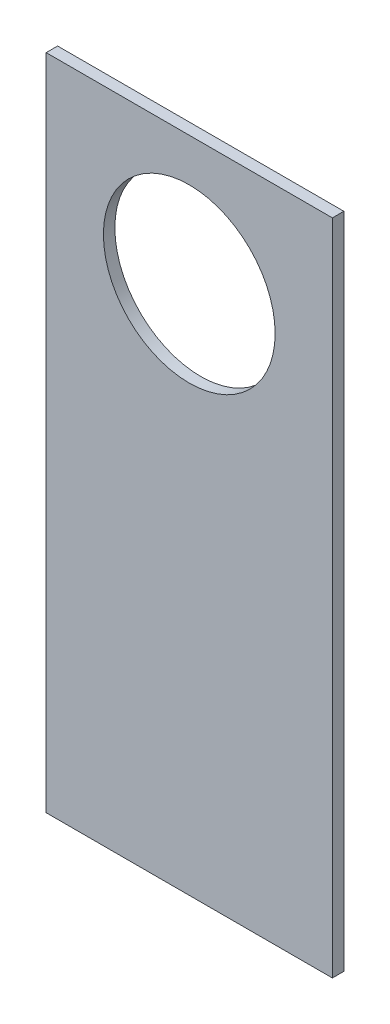
from build123d import *

# Parameters (mm, degrees)
SKETCH_1_W          = 200
SKETCH_1_H          = 460
EXTRUDE_1_DEPTH     = 8
SKETCH_2_R          = 60
CUT_EXTRUDE_1_DEPTH = 10


with BuildPart() as part:
    # 草图1 → 凸台-拉伸1 (new body)
    with BuildSketch(Plane.XY):
        with Locations((0, 230)):
            Rectangle(SKETCH_1_W, SKETCH_1_H)
    extrude(amount=EXTRUDE_1_DEPTH)

    # 草图2 → 切除-拉伸1 (cut)
    with BuildSketch(Plane(origin=(0, 0, 0), x_dir=(-1, 0, 0), z_dir=(0, 0, -1))):
        with Locations((0, 370)):
            Circle(SKETCH_2_R)
    extrude(amount=-CUT_EXTRUDE_1_DEPTH, mode=Mode.SUBTRACT)


solid = part.part
